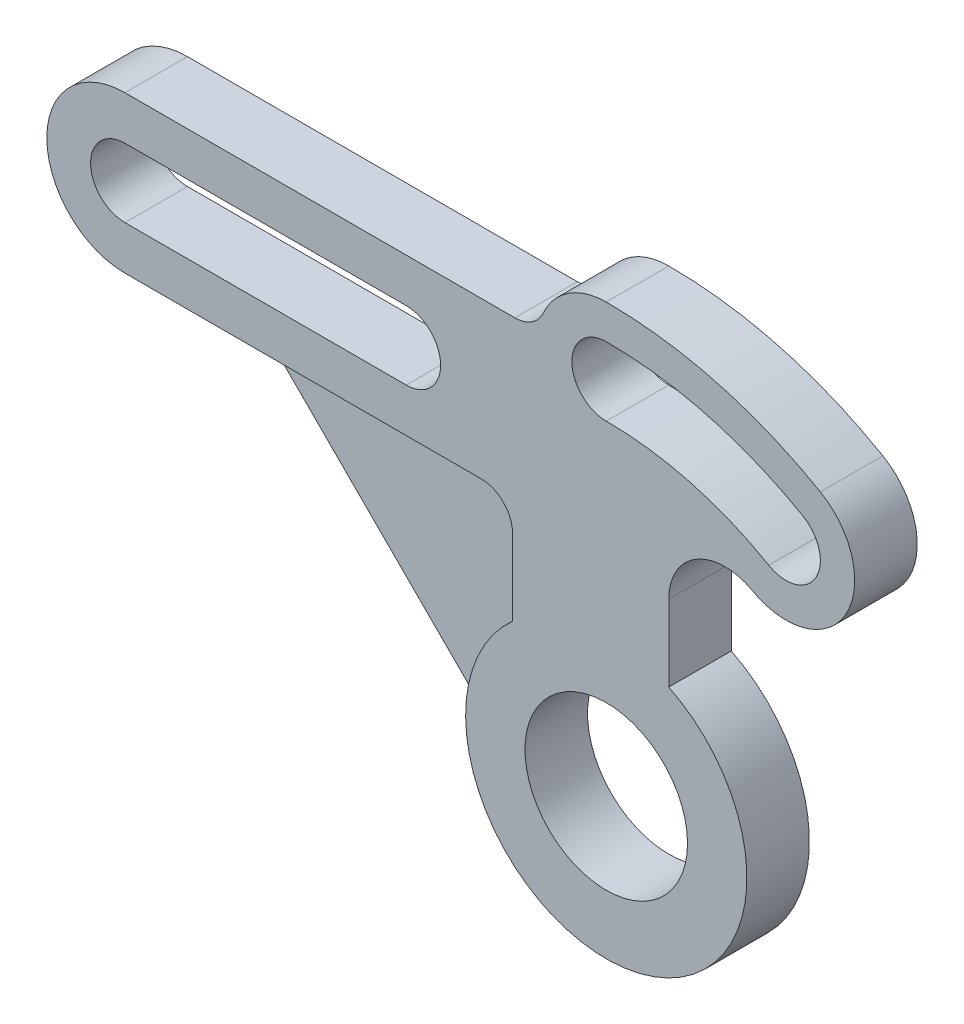
from build123d import *

# Parameters (mm, degrees)
SKETCH_1_R      = 26
EXTRUDE_1_DEPTH = 10
EXTRUDE_2_DEPTH = 5
FILLET_1_R      = 18


with BuildPart() as part:
    # 草图1 → 凸台-拉伸1 (new, symmetric)
    with BuildSketch(Plane.XY):
        with BuildLine():
            ThreePointArc((-40, -25), (-32.928932188, -27.928932188), (-30, -35))
            Line((-30, -35), (-30, -59.458980338))
            ThreePointArc((-30, -59.458980338), (-41.079191813, -74.628826929), (-45, -93))
            ThreePointArc((-45, -93), (23.717082451, -131.242646352), (20, -52.688711259))
            Line((20, -52.688711259), (20, -28.326269101))
            ThreePointArc((20, -28.326269101), (28.753378996, -12.882823889), (46.5, -12.459637448))
            ThreePointArc((46.5, -12.459637448), (76.552558883, -4.407078565), (68.5, 25.645480318))
            ThreePointArc((68.5, 25.645480318), (35.458209179, 39.331838202), (0, 44))
            ThreePointArc((0, 44), (-11.986972095, 40.447560814), (-20.102763336, 30.9375))
            ThreePointArc((-20.102763336, 30.9375), (-23.791759355, 26.614745084), (-29.240383034, 25))
            Line((-29.240383034, 25), (-154, 25))
            ThreePointArc((-154, 25), (-179, 0), (-154, -25))
            Line((-154, -25), (-113, -25))
            Line((-113, -25), (-40, -25))
        make_face()
        with Locations((0, -93)):
            Circle(SKETCH_1_R, mode=Mode.SUBTRACT)
        with BuildLine():
            ThreePointArc((-154, -11), (-165, 0), (-154, 11))
            Line((-154, 11), (-64, 11))
            ThreePointArc((-64, 11), (-53, 0), (-64, -11))
            Line((-64, -11), (-154, -11))
        make_face(mode=Mode.SUBTRACT)
        with BuildLine():
            ThreePointArc((0, 33), (32.611199683, 28.706654112), (63, 16.119200877))
            ThreePointArc((63, 16.119200877), (67.026279442, 1.092921435), (52, -2.933358006))
            ThreePointArc((52, -2.933358006), (26.917180691, 7.456285934), (0, 11))
            ThreePointArc((0, 11), (-11, 22), (0, 33))
        make_face(mode=Mode.SUBTRACT)
    extrude(amount=EXTRUDE_1_DEPTH, both=True)

    # 草图1<3> → 凸台-拉伸2 (add, symmetric)
    with BuildSketch(Plane.XY):
        with BuildLine():
            Line((-30, -59.458980338), (-30, -35))
            ThreePointArc((-30, -35), (-32.928932188, -27.928932188), (-40, -25))
            Line((-40, -25), (-113, -25))
            Line((-113, -25), (-45, -93))
            ThreePointArc((-45, -93), (-41.079191813, -74.628826929), (-30, -59.458980338))
        make_face()
    extrude(amount=EXTRUDE_2_DEPTH, both=True)

    # 圆角1
    fillet_1_edges = [part.edges().sort_by_distance(p)[0] for p in [
        (-113, -25, 0),
        (-45, -93, 0),
    ]]
    fillet(fillet_1_edges, radius=FILLET_1_R)


solid = part.part
